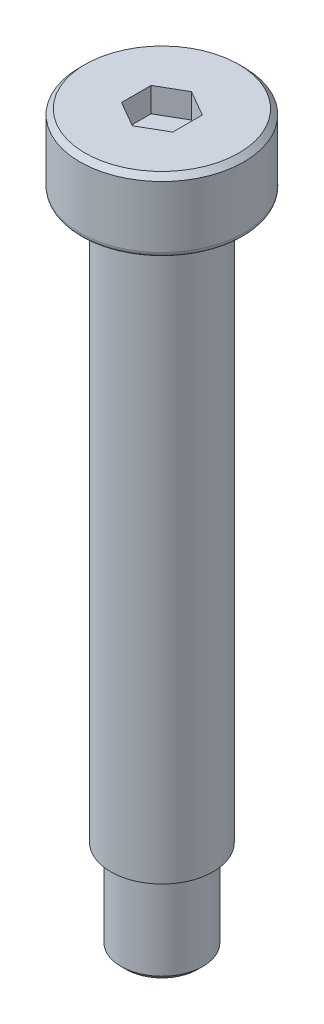
from build123d import *

# Parameters (mm, degrees)
CUT_EXTRUDE1_DEPTH = 2.4
CHAMFER1_SIZE      = 0.5
FILLET1_R          = 0.5
CHAMFER2_SIZE      = 0.5


with BuildPart() as part:
    # Sketch1 → Revolve1 (revolve)
    with BuildSketch(Plane.XY, mode=Mode.PRIVATE) as revolve1_sk:
        Polygon((0, 0), (8, 0), (8, -7), (4.75, -7), (4.75, -7.5), (5, -7.5), (5, -62), (4, -62), (4, -71), (0, -71), align=None)
    revolve(revolve1_sk.sketch.rotate(Axis((0, 5, 0), (0, -1, 0)), 180), axis=Axis((0, 5, 0), (0, -1, 0)))

    # Sketch2 → Cut-Extrude1 (cut)
    with BuildSketch(Plane(origin=(0, 0, 0), x_dir=(1, 0, 0), z_dir=(0, 1, 0))):
        Polygon((0, -2.886751346), (2.5, -1.443375673), (2.5, 1.443375673), (0, 2.886751346), (-2.5, 1.443375673), (-2.5, -1.443375673), align=None)
    extrude(amount=-CUT_EXTRUDE1_DEPTH, mode=Mode.SUBTRACT)

    # Chamfer1
    chamfer1_edges = [part.edges().sort_by_distance(p)[0] for p in [
        (8, 0, 0),
    ]]
    chamfer(chamfer1_edges, length=CHAMFER1_SIZE)

    # Fillet1
    fillet1_edges = [part.edges().sort_by_distance(p)[0] for p in [
        (8, -7, 0),
    ]]
    fillet(fillet1_edges, radius=FILLET1_R)

    # Chamfer2
    chamfer2_edges = [part.edges().sort_by_distance(p)[0] for p in [
        (4, -71, 0),
    ]]
    chamfer(chamfer2_edges, length=CHAMFER2_SIZE)


solid = part.part
